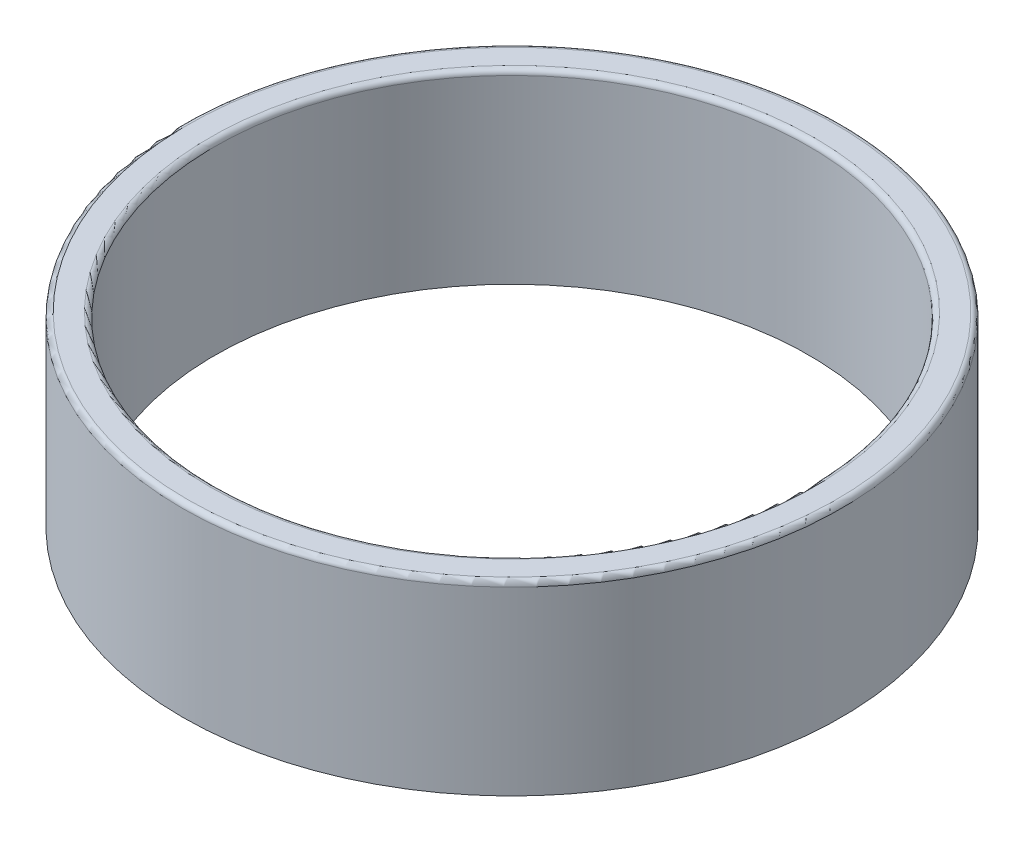
from build123d import *

# Parameters (mm, degrees)
SKETCH1_R           = 40.9194
SKETCH1_R_2         = 36.9062
BOSS_EXTRUDE1_DEPTH = 23.0886
FILLET1_R           = 0.635


with BuildPart() as part:
    # Sketch1 → Boss-Extrude1 (new body)
    with BuildSketch(Plane(origin=(0, 0, 0), x_dir=(1, 0, 0), z_dir=(0, 1, 0))):
        with Locations(Location((0, 0, 0), (0, 0, 270))):
            Circle(SKETCH1_R)
        with Locations(Location((0, 0, 0), (0, 0, 270))):
            Circle(SKETCH1_R_2, mode=Mode.SUBTRACT)
    extrude(amount=BOSS_EXTRUDE1_DEPTH)

    # Fillet1
    fillet1_edges = [part.edges().sort_by_distance(p)[0] for p in [
        (0, 23.0886, -40.9194),
        (0, 23.0886, -36.9062),
    ]]
    fillet(fillet1_edges, radius=FILLET1_R)


solid = part.part
